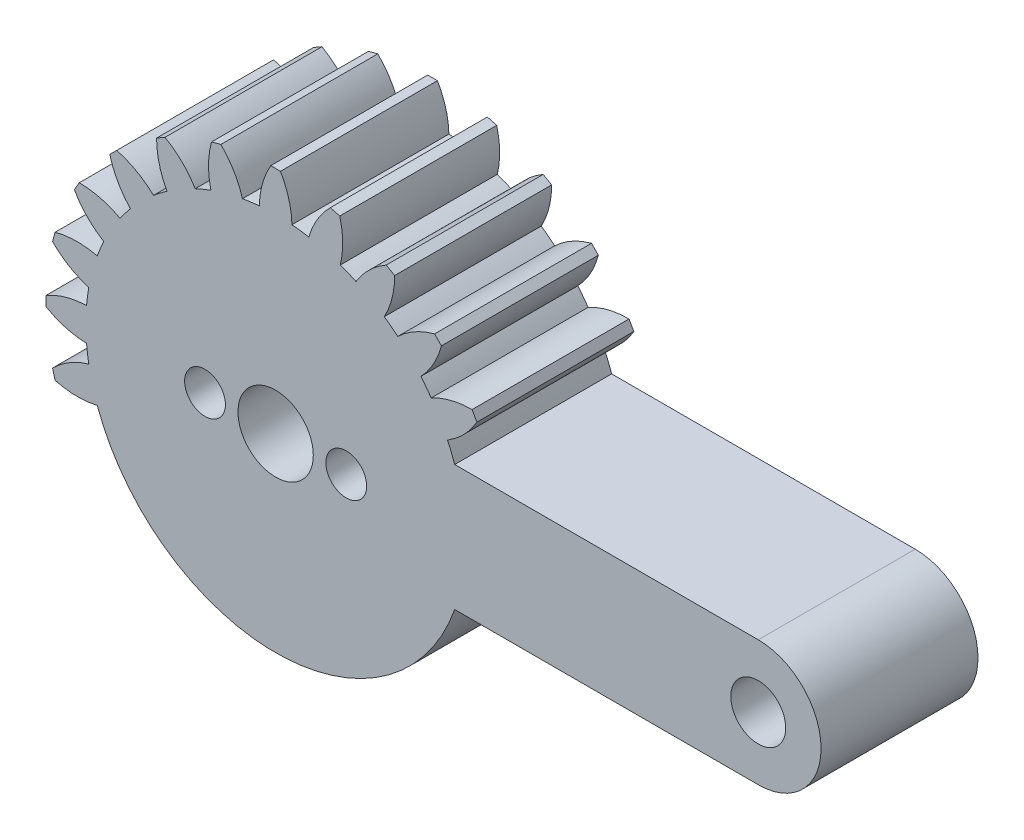
from build123d import *

# Parameters (mm, degrees)
SKETCH1_R           = 1.75
BOSS_EXTRUDE4_DEPTH = 10
SKETCH2_R           = 1.3
SKETCH2_R_2         = 2.4
CUT_EXTRUDE1_DEPTH  = 40.007683858


with BuildPart() as part:
    # Sketch1 → Boss-Extrude4 (new body)
    with BuildSketch(Plane.XY):
        with BuildLine():
            Line((0.31, 14.63), (-0.31, 14.63))
            ThreePointArc((-0.31, 14.63), (-0.838273314, 13.383704325), (-1.04, 12.04518576))
            ThreePointArc((-1.04, 12.04518576), (-1.578061664, 11.986568374), (-2.112960617, 11.903927815))
            ThreePointArc((-2.112960617, 11.903927815), (-2.65424773, 13.144626757), (-3.487085624, 14.211728743))
            Line((-3.487085624, 14.211728743), (-4.085959636, 14.051260935))
            ThreePointArc((-4.085959636, 14.051260935), (-4.273667417, 12.71070456), (-4.122086336, 11.365584201))
            ThreePointArc((-4.122086336, 11.365584201), (-4.626642697, 11.169703548), (-5.12192646, 10.951436862))
            ThreePointArc((-5.12192646, 10.951436862), (-5.965886177, 12.009764599), (-7.046532125, 12.824951657))
            Line((-7.046532125, 12.824951657), (-7.583467875, 12.514951657))
            ThreePointArc((-7.583467875, 12.514951657), (-7.417818147, 11.171491285), (-6.9232593, 9.911436862))
            ThreePointArc((-6.9232593, 9.911436862), (-7.359925677, 9.591641884), (-7.781841479, 9.252623584))
            ThreePointArc((-7.781841479, 9.252623584), (-8.870959341, 10.05645683), (-10.125769107, 10.564175311))
            Line((-10.125769107, 10.564175311), (-10.564175311, 10.125769107))
            ThreePointArc((-10.564175311, 10.125769107), (-10.05645683, 8.870959341), (-9.252623584, 7.781841479))
            ThreePointArc((-9.252623584, 7.781841479), (-9.591641884, 7.359925677), (-9.911436862, 6.9232593))
            ThreePointArc((-9.911436862, 6.9232593), (-11.171491285, 7.417818147), (-12.514951657, 7.583467875))
            Line((-12.514951657, 7.583467875), (-12.824951657, 7.046532125))
            ThreePointArc((-12.824951657, 7.046532125), (-12.009764599, 5.965886177), (-10.951436862, 5.12192646))
            ThreePointArc((-10.951436862, 5.12192646), (-11.169703548, 4.626642697), (-11.365584201, 4.122086336))
            ThreePointArc((-11.365584201, 4.122086336), (-12.71070456, 4.273667417), (-14.051260935, 4.085959636))
            Line((-14.051260935, 4.085959636), (-14.211728743, 3.487085624))
            ThreePointArc((-14.211728743, 3.487085624), (-13.144626757, 2.65424773), (-11.903927815, 2.112960617))
            ThreePointArc((-11.903927815, 2.112960617), (-11.986568374, 1.578061664), (-12.04518576, 1.04))
            ThreePointArc((-12.04518576, 1.04), (-13.383704325, 0.838273314), (-14.63, 0.31))
            Line((-14.63, 0.31), (-14.63, -0.31))
            ThreePointArc((-14.63, -0.31), (-13.383704325, -0.838273314), (-12.04518576, -1.04))
            ThreePointArc((-12.04518576, -1.04), (-11.986568374, -1.578061664), (-11.903927815, -2.112960617))
            ThreePointArc((-11.903927815, -2.112960617), (-13.144626757, -2.65424773), (-14.211728743, -3.487085624))
            Line((-14.211728743, -3.487085624), (-14.051260935, -4.085959636))
            ThreePointArc((-14.051260935, -4.085959636), (-12.71070456, -4.273667417), (-11.365584201, -4.122086336))
            ThreePointArc((-11.365584201, -4.122086336), (0.064808849, -12.089826294), (11.409123542, -4))
            Line((11.409123542, -4), (30.75, -4))
            ThreePointArc((30.75, -4), (34.75, 0), (30.75, 4))
            Line((30.75, 4), (11.409123542, 4))
            ThreePointArc((11.409123542, 4), (11.194344337, 4.566700654), (10.951436862, 5.12192646))
            ThreePointArc((10.951436862, 5.12192646), (12.009764599, 5.965886177), (12.824951657, 7.046532125))
            Line((12.824951657, 7.046532125), (12.514951657, 7.583467875))
            ThreePointArc((12.514951657, 7.583467875), (11.171491285, 7.417818147), (9.911436862, 6.9232593))
            ThreePointArc((9.911436862, 6.9232593), (9.591641884, 7.359925677), (9.252623584, 7.781841479))
            ThreePointArc((9.252623584, 7.781841479), (10.05645683, 8.870959341), (10.564175311, 10.125769107))
            Line((10.564175311, 10.125769107), (10.125769107, 10.564175311))
            ThreePointArc((10.125769107, 10.564175311), (8.870959341, 10.05645683), (7.781841479, 9.252623584))
            ThreePointArc((7.781841479, 9.252623584), (7.359925677, 9.591641884), (6.9232593, 9.911436862))
            ThreePointArc((6.9232593, 9.911436862), (7.417818147, 11.171491285), (7.583467875, 12.514951657))
            Line((7.583467875, 12.514951657), (7.046532125, 12.824951657))
            ThreePointArc((7.046532125, 12.824951657), (5.965886177, 12.009764599), (5.12192646, 10.951436862))
            ThreePointArc((5.12192646, 10.951436862), (4.626642697, 11.169703548), (4.122086336, 11.365584201))
            ThreePointArc((4.122086336, 11.365584201), (4.273667417, 12.71070456), (4.085959636, 14.051260935))
            Line((4.085959636, 14.051260935), (3.487085624, 14.211728743))
            ThreePointArc((3.487085624, 14.211728743), (2.65424773, 13.144626757), (2.112960617, 11.903927815))
            ThreePointArc((2.112960617, 11.903927815), (1.578061664, 11.986568374), (1.04, 12.04518576))
            ThreePointArc((1.04, 12.04518576), (0.838273314, 13.383704325), (0.31, 14.63))
        make_face()
        Circle(SKETCH1_R, mode=Mode.SUBTRACT)
        with Locations((30.75, 0)):
            Circle(SKETCH1_R, mode=Mode.SUBTRACT)
    extrude(amount=BOSS_EXTRUDE4_DEPTH)

    # Sketch2 → Cut-Extrude1 (cut, through all)
    with BuildSketch(Plane.XY.offset(10)):
        with Locations((-4.5, 0)):
            Circle(SKETCH2_R)
        with Locations((4.5, 0)):
            Circle(SKETCH2_R)
        Circle(SKETCH2_R_2)
    extrude(amount=-CUT_EXTRUDE1_DEPTH, mode=Mode.SUBTRACT)


solid = part.part
